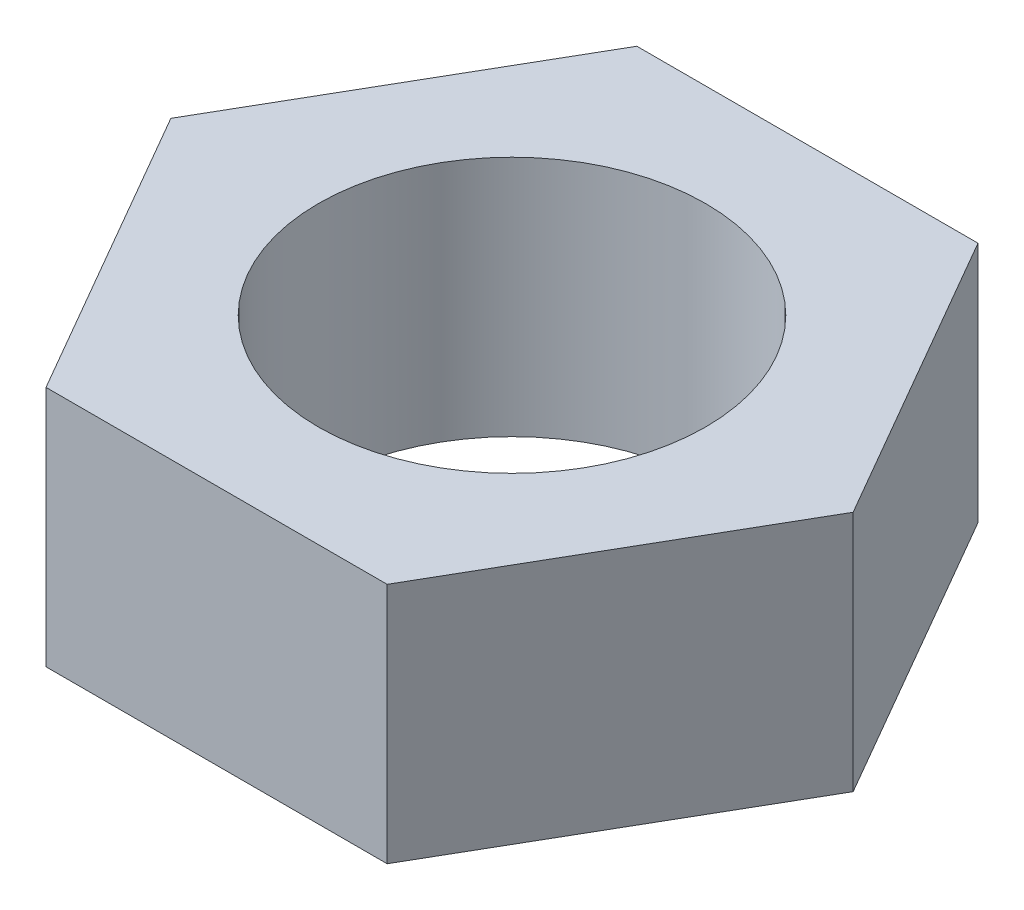
from build123d import *

# Parameters (mm, degrees)
CROQUIS1_R              = 4
SALIENTE_EXTRUIR1_DEPTH = 5


with BuildPart() as part:
    # Croquis1 → Saliente-Extruir1 (new body)
    with BuildSketch(Plane(origin=(0, 0, 0), x_dir=(1, 0, 0), z_dir=(0, 1, 0))):
        Polygon((7.048017094, 0), (3.524008547, 6.103761849), (-3.524008547, 6.103761849), (-7.048017094, 0), (-3.524008547, -6.103761849), (3.524008547, -6.103761849), align=None)
        with Locations(Location((0, 0, 0), (0, 0, 270))):
            Circle(CROQUIS1_R, mode=Mode.SUBTRACT)
    extrude(amount=SALIENTE_EXTRUIR1_DEPTH)


solid = part.part
